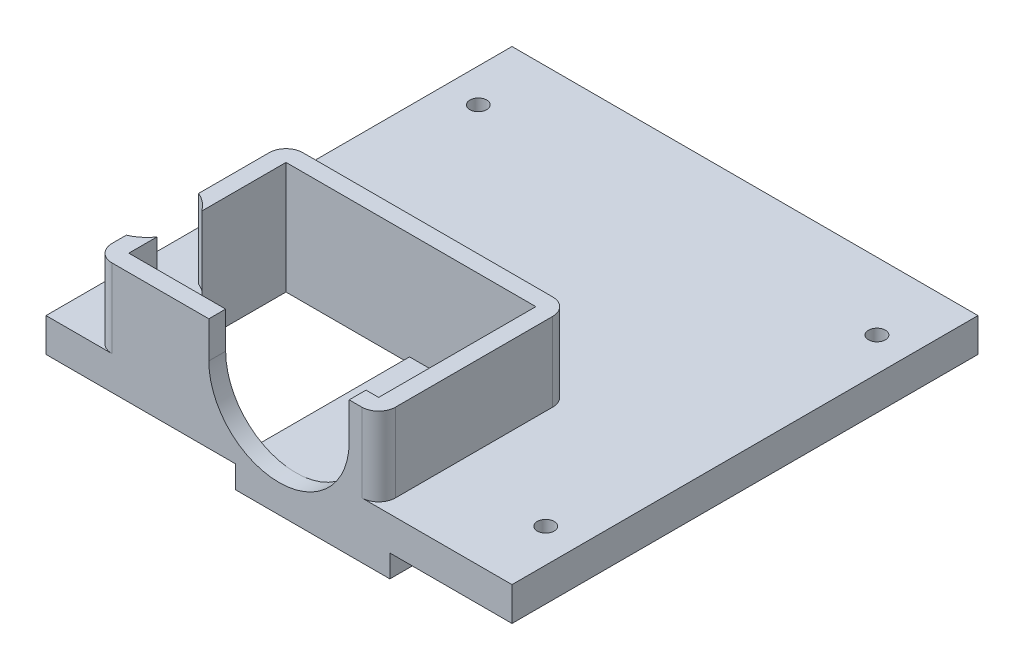
from build123d import *

# Parameters (mm, degrees)
SKETCH1_W                                = 83
SKETCH1_H                                = 83
BOSS_EXTRUDE1_DEPTH                      = 6
SKETCH2_R                                = 1.5
CUT_EXTRUDE1_DEPTH                       = 118.532974097
SKETCH5_W                                = 50.5
SKETCH5_H                                = 34
BOSS_EXTRUDE2_DEPTH                      = 22
SKETCH6_W                                = 44.5
SKETCH6_H                                = 28
CUT_EXTRUDE5_DEPTH                       = 25
FILLET1_R                                = 3
SKETCH8_R                                = 12.5
CUT_EXTRUDE6_DEPTH                       = 10
CUT_EXTRUDE7_DEPTH                       = 121.673112167
CUT_EXTRUDE7_DEPTH_BACK                  = 121.673112167
SKETCH9_W                                = 83
SKETCH9_H                                = 8
CUT_EXTRUDE8_DEPTH                       = 3
MIRROR1_AT_THE_SECOND_PLANE_COPY_1_DEPTH = 3
CUT_EXTRUDE9_DEPTH                       = 14
CUT_EXTRUDE10_DEPTH                      = 10
CUT_EXTRUDE11_DEPTH                      = 10
BOSS_EXTRUDE3_DEPTH                      = 3
CUT_EXTRUDE14_DEPTH                      = 4
SKETCH20_W                               = 13.564659966
SKETCH20_H                               = 7
CUT_EXTRUDE15_DEPTH                      = 4
BOSS_EXTRUDE4_DEPTH                      = 4
BOSS_EXTRUDE4_DEPTH_BACK                 = 1
SKETCH21_W                               = 27.5
SKETCH21_H                               = 37
FILLET2_R                                = 5


with BuildPart() as part:
    # Sketch1 → Boss-Extrude1 (new body)
    with BuildSketch(Plane(origin=(0, 0, 0), x_dir=(1, 0, 0), z_dir=(0, 1, 0))):
        with Locations((41.5, 41.5)):
            Rectangle(SKETCH1_W, SKETCH1_H)
    extrude(amount=BOSS_EXTRUDE1_DEPTH)

    # Sketch2 → Cut-Extrude1 (cut, through all)
    with BuildSketch(Plane(origin=(0, 6, 0), x_dir=(1, 0, 0), z_dir=(0, 1, 0))):
        with Locations(Location((6, 71, 0), (0, 0, 270))):
            Circle(SKETCH2_R)
        with Locations(Location((6, 12, 0), (0, 0, 270))):
            Circle(SKETCH2_R)
        with Locations(Location((77, 12, 0), (0, 0, 270))):
            Circle(SKETCH2_R)
        with Locations(Location((77, 71, 0), (0, 0, 270))):
            Circle(SKETCH2_R)
    extrude(amount=-CUT_EXTRUDE1_DEPTH, mode=Mode.SUBTRACT)

    # Sketch5 → Boss-Extrude2 (add)
    with BuildSketch(Plane(origin=(0, 6, 0), x_dir=(1, 0, 0), z_dir=(0, 1, 0))):
        with Locations((34, 17)):
            Rectangle(SKETCH5_W, SKETCH5_H)
    extrude(amount=BOSS_EXTRUDE2_DEPTH)

    # Sketch6 → Cut-Extrude5 (cut)
    with BuildSketch(Plane(origin=(0, 28, 0), x_dir=(1, 0, 0), z_dir=(0, 1, 0))):
        with Locations((34, 17)):
            Rectangle(SKETCH6_W, SKETCH6_H)
    extrude(amount=-CUT_EXTRUDE5_DEPTH, mode=Mode.SUBTRACT)

    # Fillet1
    fillet1_edges = [part.edges().sort_by_distance(p)[0] for p in [
        (59.25, 17, -34),
        (8.75, 17, -34),
        (8.75, 17, 0),
        (59.25, 17, 0),
    ]]
    fillet(fillet1_edges, radius=FILLET1_R)

    # Sketch8 → Cut-Extrude6 (cut)
    with BuildSketch(Plane.XY):
        with Locations((41.5, 13.5)):
            Circle(SKETCH8_R)
    extrude(amount=-CUT_EXTRUDE6_DEPTH, mode=Mode.SUBTRACT)

    # Sketch9 → Cut-Extrude7 (cut, two sides: drawn at the far end of the back side and taken through both)
    with BuildSketch(Plane.XY.offset(-CUT_EXTRUDE7_DEPTH_BACK)):
        with Locations((41.5, 24)):
            Rectangle(SKETCH9_W, SKETCH9_H)
    extrude(amount=CUT_EXTRUDE7_DEPTH + CUT_EXTRUDE7_DEPTH_BACK, mode=Mode.SUBTRACT)

    # Sketch11 → Cut-Extrude8 (cut)
    with BuildSketch(Plane.XZ):
        Polygon((3, -9), (13, -9), (13, -15), (8, -21), (3, -21), align=None)
    cut_extrude8 = extrude(amount=-CUT_EXTRUDE8_DEPTH, mode=Mode.SUBTRACT)

    # Mirror1: Cut-Extrude8 across plane
    add(cut_extrude8.mirror(Plane.XY.offset(-41.5)), mode=Mode.SUBTRACT)

    # Mirror1 at the second plane: Cut-Extrude8 across plane
    add(cut_extrude8.mirror(Plane.ZY.offset(-41.5)), mode=Mode.SUBTRACT)

    # Mirror1 at the second plane copy 1 sketc → Mirror1 at the second plane copy 1 (cut)
    with BuildSketch(Plane(origin=(83, 0, -83), x_dir=(-1, 0, 0), z_dir=(0, -1, 0))):
        Polygon((3, -9), (13, -9), (13, -15), (8, -21), (3, -21), align=None)
    extrude(amount=-MIRROR1_AT_THE_SECOND_PLANE_COPY_1_DEPTH, mode=Mode.SUBTRACT)

    # Sketch13 → Cut-Extrude9 (cut)
    with BuildSketch(Plane(origin=(0, 20, 0), x_dir=(1, 0, 0), z_dir=(0, 1, 0))):
        with BuildLine():
            Line((11.75, 8.007820144), (11.75, 15.992179856))
            ThreePointArc((11.75, 15.992179856), (10.422332723, 17.426137972), (8.75, 18.437196595))
            Line((8.75, 18.437196595), (8.75, 5.562803405))
            ThreePointArc((8.75, 5.562803405), (10.422332723, 6.573862028), (11.75, 8.007820144))
        make_face()
    extrude(amount=-CUT_EXTRUDE9_DEPTH, mode=Mode.SUBTRACT)

    # Sketch14 → Cut-Extrude10 (cut)
    with BuildSketch(Plane.XY):
        Polygon((29, 13.5), (29, 20), (30.822921748, 20), align=None)
    extrude(amount=-CUT_EXTRUDE10_DEPTH, mode=Mode.SUBTRACT)

    # Sketch15 → Cut-Extrude11 (cut)
    with BuildSketch(Plane.XY):
        Polygon((54, 20), (54, 13.5), (52.177078252, 20), align=None)
    extrude(amount=-CUT_EXTRUDE11_DEPTH, mode=Mode.SUBTRACT)

    # Sketch17 → Boss-Extrude3 (add)
    with BuildSketch(Plane.XZ):
        Polygon((9.666666667, -9), (9.666666667, -19), (13, -15), (13, -9), align=None)
    extrude(amount=-BOSS_EXTRUDE3_DEPTH)

    # Sketch18 → Cut-Extrude14 (cut)
    with BuildSketch(Plane(origin=(0, 3, 0), x_dir=(1, 0, 0), z_dir=(0, 1, 0))):
        Polygon((34.717670017, 3), (34.717670017, 10), (48.282329983, 10), (48.282329983, 3), (56.25, 3), (56.25, 31), (11.75, 31), (11.75, 3), align=None)
    extrude(amount=-CUT_EXTRUDE14_DEPTH, mode=Mode.SUBTRACT)

    # Sketch20 → Cut-Extrude15 (cut)
    with BuildSketch(Plane.XZ):
        with Locations((41.5, -6.5)):
            Rectangle(SKETCH20_W, SKETCH20_H)
    extrude(amount=-CUT_EXTRUDE15_DEPTH, mode=Mode.SUBTRACT)

    # Sketch21 → Boss-Extrude4 (add, two sides: drawn at the far end of the back side and taken through both)
    with BuildSketch(Plane.XZ.offset(-BOSS_EXTRUDE4_DEPTH_BACK)):
        with Locations((47.5, -18.5)):
            Rectangle(SKETCH21_W, SKETCH21_H)
    extrude(amount=BOSS_EXTRUDE4_DEPTH + BOSS_EXTRUDE4_DEPTH_BACK)

    # Fillet2
    fillet2_edges = [part.edges().sort_by_distance(p)[0] for p in [
        (33.75, -2, -37),
        (61.25, -2, -37),
    ]]
    fillet(fillet2_edges, radius=FILLET2_R)


solid = part.part
